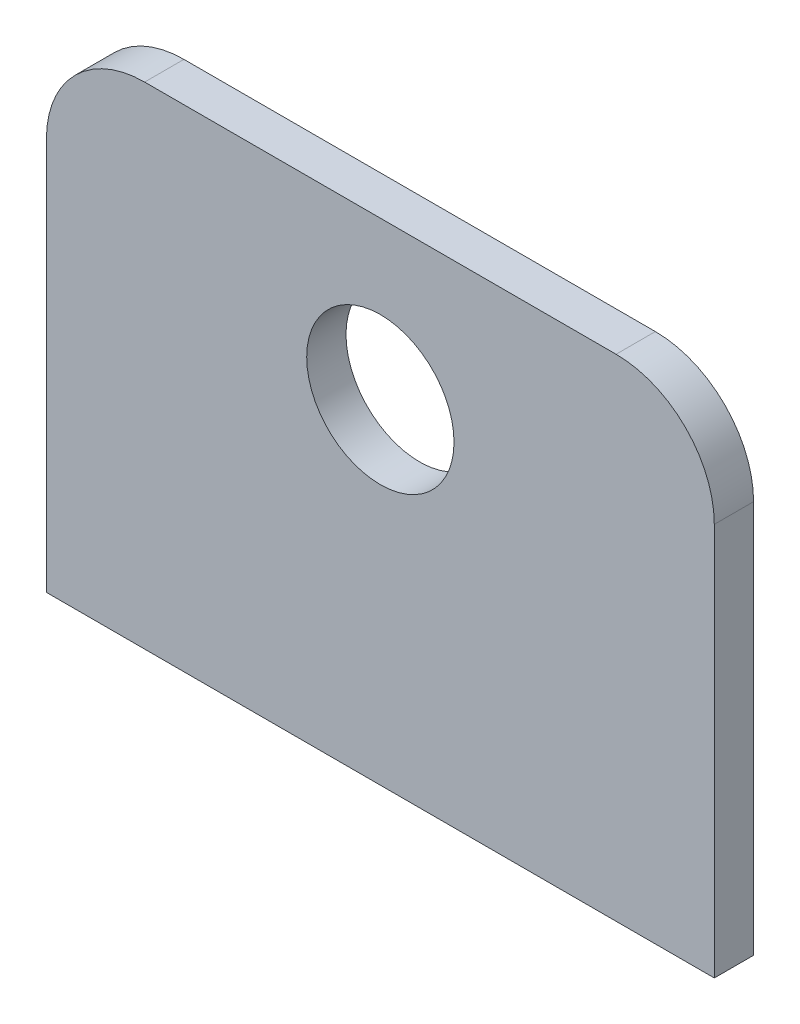
from build123d import *

# Parameters (mm, degrees)
SKETCH1_W           = 68
SKETCH1_H           = 50
BOSS_EXTRUDE1_DEPTH = 4
SKETCH4_R           = 7.5
CUT_EXTRUDE1_DEPTH  = 10
FILLET1_R           = 10


with BuildPart() as part:
    # Sketch1 → Boss-Extrude1 (new body)
    with BuildSketch(Plane.XY):
        with Locations((-34, 25)):
            Rectangle(SKETCH1_W, SKETCH1_H)
    extrude(amount=BOSS_EXTRUDE1_DEPTH)

    # Sketch4 → Cut-Extrude1 (cut)
    with BuildSketch(Plane(origin=(0, 0, 0), x_dir=(-1, 0, 0), z_dir=(0, 0, -1))):
        with Locations((34, 34)):
            Circle(SKETCH4_R)
    extrude(amount=-CUT_EXTRUDE1_DEPTH, mode=Mode.SUBTRACT)

    # Fillet1
    fillet1_edges = [part.edges().sort_by_distance(p)[0] for p in [
        (0, 50, 2),
        (-68, 50, 2),
    ]]
    fillet(fillet1_edges, radius=FILLET1_R)


solid = part.part
